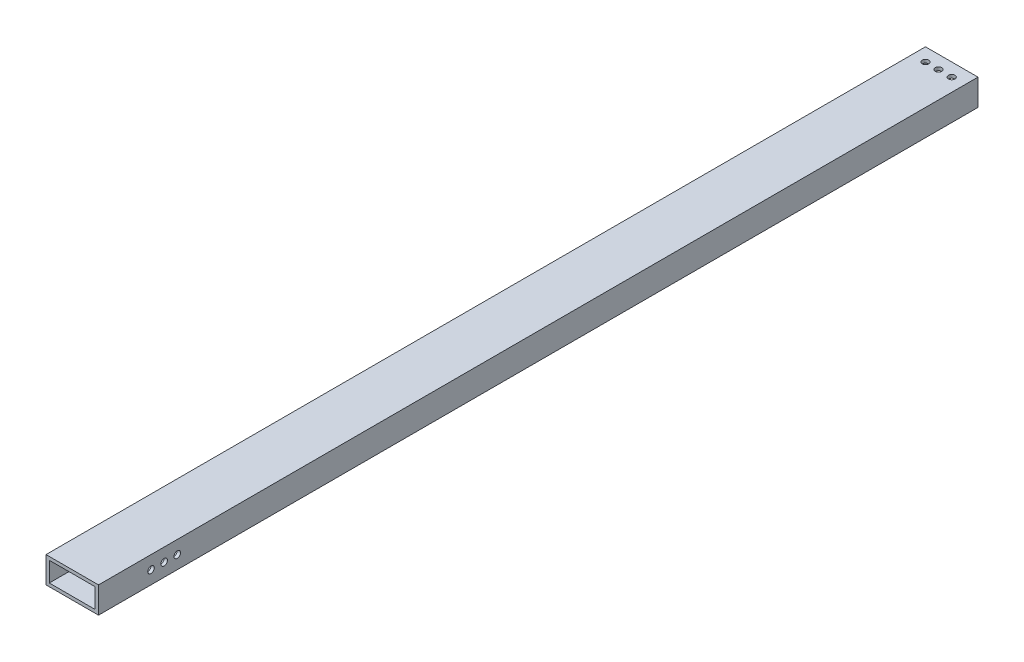
from build123d import *

# Parameters (mm, degrees)
SKETCH1_W                   = 50.8
SKETCH1_H                   = 25.4
SKETCH1_W_2                 = 44.45
SKETCH1_H_2                 = 19.05
BOSS_EXTRUDE1_DEPTH         = 850.9
CUT_EXTRUDE1_DEPTH          = 853.793415781
CUT_EXTRUDE1_DEPTH_BACK     = 853.793415781
SKETCH2_R                   = 3.175
F_1_4_0_25_DIAMETER_HOLE3_D = 6.35


with BuildPart() as part:
    # Sketch1 → Boss-Extrude1 (new body)
    with BuildSketch(Plane.XY):
        with Locations((25.4, 12.7)):
            Rectangle(SKETCH1_W, SKETCH1_H)
        with Locations((25.4, 12.7)):
            Rectangle(SKETCH1_W_2, SKETCH1_H_2, mode=Mode.SUBTRACT)
    extrude(amount=BOSS_EXTRUDE1_DEPTH)

    # Sketch2 → Cut-Extrude1 (cut, two sides: drawn at the far end of the back side and taken through both)
    with BuildSketch(Plane(origin=(50.8, 0, 0), x_dir=(0, 0, -1), z_dir=(1, 0, 0)).offset(-CUT_EXTRUDE1_DEPTH_BACK)):
        with Locations(Location((-800.1, 12.7, 0), (0, 0, 180))):
            Circle(SKETCH2_R)
        with Locations(Location((-787.4, 12.7, 0), (0, 0, 180))):
            Circle(SKETCH2_R)
        with Locations(Location((-774.7, 12.7, 0), (0, 0, 180))):
            Circle(SKETCH2_R)
    extrude(amount=CUT_EXTRUDE1_DEPTH + CUT_EXTRUDE1_DEPTH_BACK, mode=Mode.SUBTRACT)

    # 1/4 (0.25) Diameter Hole3 (through all)
    with Locations(Plane(origin=(0, 25.4, 0), x_dir=(1, 0, 0), z_dir=(0, 1, 0))):
        with Locations((12.7, -12.7), (25.4, -12.7), (38.1, -12.7)):
            Hole(F_1_4_0_25_DIAMETER_HOLE3_D / 2)


solid = part.part
